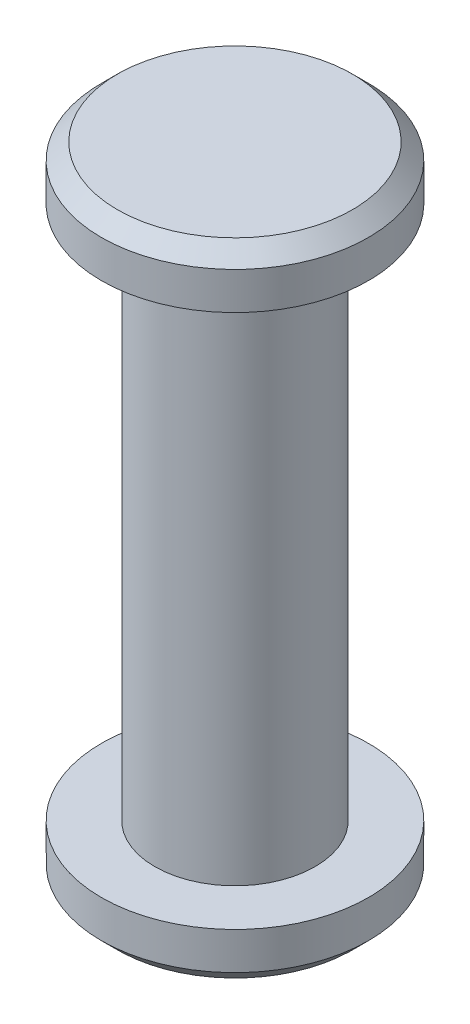
from build123d import *

# Parameters (mm, degrees)
CHAMFER1_SIZE = 3


with BuildPart() as part:
    # Sketch2 → Revolve1 (revolve)
    with BuildSketch(Plane.XY, mode=Mode.PRIVATE) as revolve1_sk:
        Polygon((0, 60), (-25, 60), (-25, 50), (-15, 50), (-15, -50), (-25, -50), (-25, -60), (0, -60), (0, 0), align=None)
    revolve(revolve1_sk.sketch.rotate(Axis((0, 100.283380957, 0), (0, -1, 0)), 270), axis=Axis((0, 100.283380957, 0), (0, -1, 0)))

    # Chamfer1
    chamfer1_edges = [part.edges().sort_by_distance(p)[0] for p in [
        (0, 60, -25),
        (0, -60, -25),
    ]]
    chamfer(chamfer1_edges, length=CHAMFER1_SIZE)


solid = part.part
